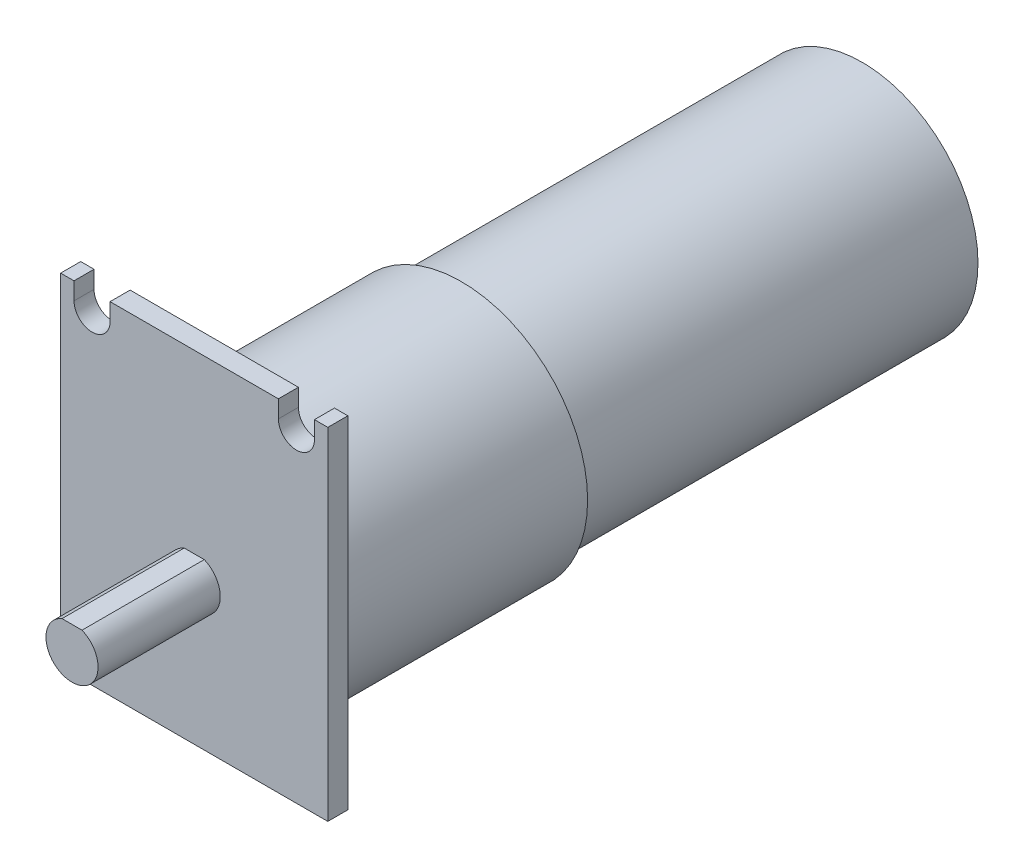
from build123d import *

# Parameters (mm, degrees)
SKETCH1_R           = 17.35
BOSS_EXTRUDE1_DEPTH = 60
SKETCH2_R           = 18.9
BOSS_EXTRUDE2_DEPTH = 37
BOSS_EXTRUDE4_DEPTH = 3
BOSS_EXTRUDE3_DEPTH = 21.3


with BuildPart() as part:
    # Sketch1 → Boss-Extrude1 (new body)
    with BuildSketch(Plane.XY):
        Circle(SKETCH1_R)
    extrude(amount=BOSS_EXTRUDE1_DEPTH)

    # Sketch2 → Boss-Extrude2 (add)
    with BuildSketch(Plane.XY.offset(60)):
        Circle(SKETCH2_R)
    extrude(amount=BOSS_EXTRUDE2_DEPTH)

    # Sketch4 → Boss-Extrude4 (add)
    with BuildSketch(Plane.XY.offset(97)):
        with BuildLine():
            Line((20, 21.1), (20, -21.1))
            Line((20, -21.1), (-20, -21.1))
            Line((-20, -21.1), (-20, 21.1))
            Line((-20, 21.1), (-20, 30))
            Line((-20, 30), (-18, 30))
            Line((-18, 30), (-18, 27.4))
            ThreePointArc((-18, 27.4), (-15.3, 24.7), (-12.6, 27.4))
            Line((-12.6, 27.4), (-12.6, 30))
            Line((-12.6, 30), (12.6, 30))
            Line((12.6, 30), (12.6, 27.4))
            ThreePointArc((12.6, 27.4), (15.3, 24.7), (18, 27.4))
            Line((18, 27.4), (18, 30))
            Line((18, 30), (20, 30))
            Line((20, 30), (20, 21.1))
        make_face()
    extrude(amount=BOSS_EXTRUDE4_DEPTH)

    # Sketch3 → Boss-Extrude3 (add)
    with BuildSketch(Plane.XY.offset(97)):
        with BuildLine():
            Line((1.5, 3.6), (0, 3.6))
            Line((0, 3.6), (-1.5, 3.6))
            ThreePointArc((-1.5, 3.6), (0, -3.9), (1.5, 3.6))
        make_face()
    extrude(amount=BOSS_EXTRUDE3_DEPTH)


solid = part.part
